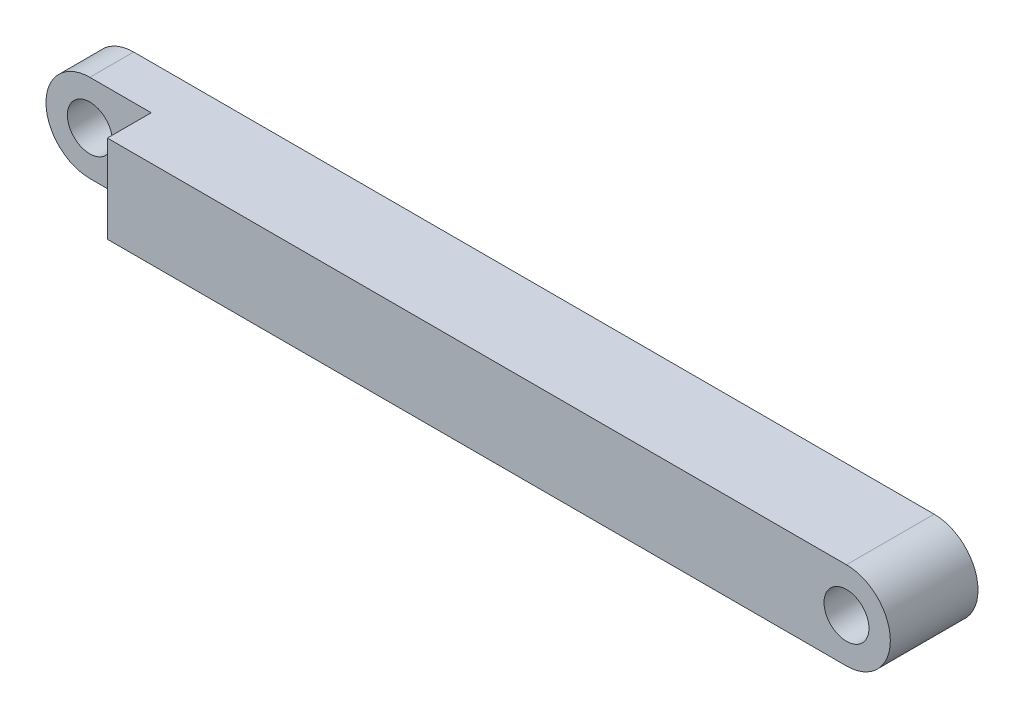
from build123d import *

# Parameters (mm, degrees)
SKETCH1_R           = 1.627
BOSS_EXTRUDE1_DEPTH = 6.35
SKETCH2_W           = 8.278201301
SKETCH2_H           = 8.19304218
CUT_EXTRUDE1_DEPTH  = 3.175


with BuildPart() as part:
    # Sketch1 → Boss-Extrude1 (new body)
    with BuildSketch(Plane.XY):
        with BuildLine():
            Line((-35.456602045, 3.175), (-7.62, 3.175))
            Line((-7.62, 3.175), (-3.175, 3.175))
            ThreePointArc((-3.175, 3.175), (-0.92993597, 2.24506403), (0, 0))
            ThreePointArc((0, 0), (-0.92993597, -2.24506403), (-3.175, -3.175))
            Line((-3.175, -3.175), (-7.62, -3.175))
            Line((-7.62, -3.175), (-35.456602045, -3.175))
            Line((-35.456602045, -3.175), (-61.15130657, -3.175))
            ThreePointArc((-61.15130657, -3.175), (-63.3963706, -2.24506403), (-64.32630657, 0))
            ThreePointArc((-64.32630657, 0), (-63.3963706, 2.24506403), (-61.15130657, 3.175))
            Line((-61.15130657, 3.175), (-35.456602045, 3.175))
        make_face()
        with Locations((-3.175, 0)):
            Circle(SKETCH1_R, mode=Mode.SUBTRACT)
        with Locations((-61.15130657, 0)):
            Circle(SKETCH1_R, mode=Mode.SUBTRACT)
    extrude(amount=BOSS_EXTRUDE1_DEPTH)

    # Sketch2 → Cut-Extrude1 (cut)
    with BuildSketch(Plane.XY.offset(6.35)):
        with Locations((-60.845407221, -0.92152109)):
            Rectangle(SKETCH2_W, SKETCH2_H)
    extrude(amount=-CUT_EXTRUDE1_DEPTH, mode=Mode.SUBTRACT)


solid = part.part
